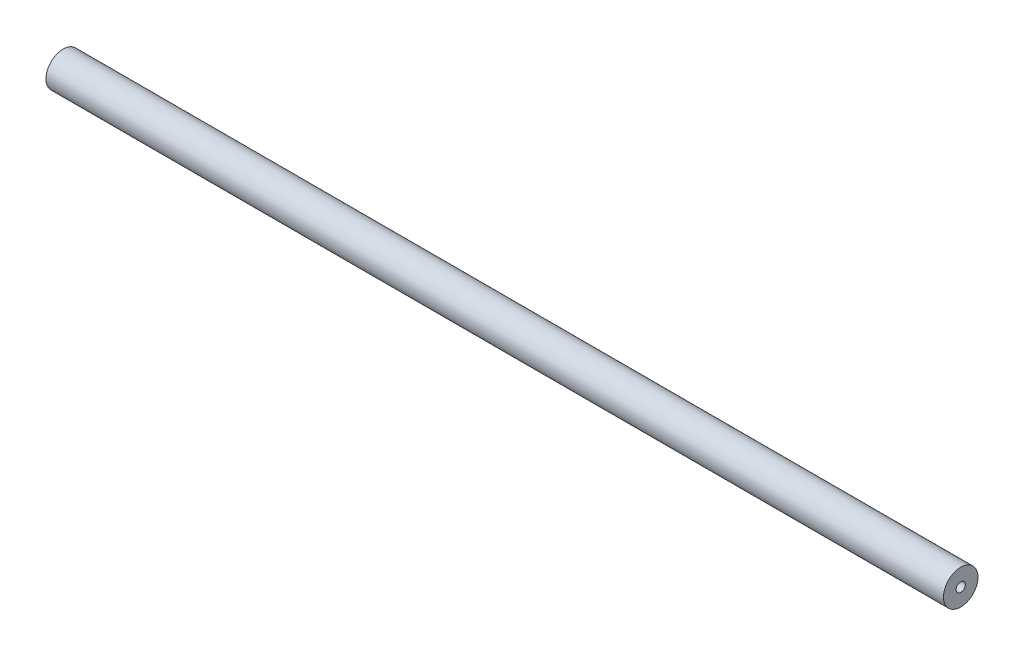
from build123d import *

# Parameters (mm, degrees)
SKETCH1_R                   = 9.525
BOSS_EXTRUDE1_DEPTH         = 495.3
F_1_4_20_TAPPED_HOLE1_D     = 5.1054
F_1_4_20_TAPPED_HOLE1_DEPTH = 16.51
F_1_4_20_TAPPED_HOLE1_TIP   = 1.533816902
F_1_4_20_TAPPED_HOLE2_D     = 5.1054
F_1_4_20_TAPPED_HOLE2_DEPTH = 16.51
F_1_4_20_TAPPED_HOLE2_TIP   = 1.533816902


with BuildPart() as part:
    # Sketch1 → Boss-Extrude1 (new body)
    with BuildSketch(Plane(origin=(0, 0, 0), x_dir=(0, 0, -1), z_dir=(1, 0, 0))):
        Circle(SKETCH1_R)
    extrude(amount=-BOSS_EXTRUDE1_DEPTH)

    # 1/4-20 Tapped Hole1
    with Locations(Plane(origin=(0, 0, 0), x_dir=(0, 0, -1), z_dir=(1, 0, 0))):
        with Locations((0, 0)):
            Hole(F_1_4_20_TAPPED_HOLE1_D / 2, depth=F_1_4_20_TAPPED_HOLE1_DEPTH)
            with Locations((0, 0, -(F_1_4_20_TAPPED_HOLE1_DEPTH + F_1_4_20_TAPPED_HOLE1_TIP / 2))):  # 118° drill point
                Cone(0, F_1_4_20_TAPPED_HOLE1_D / 2, F_1_4_20_TAPPED_HOLE1_TIP, mode=Mode.SUBTRACT)

    # 1/4-20 Tapped Hole2
    with Locations(Plane.ZY.offset(495.3)):
        with Locations((0, 0)):
            Hole(F_1_4_20_TAPPED_HOLE2_D / 2, depth=F_1_4_20_TAPPED_HOLE2_DEPTH)
            with Locations((0, 0, -(F_1_4_20_TAPPED_HOLE2_DEPTH + F_1_4_20_TAPPED_HOLE2_TIP / 2))):  # 118° drill point
                Cone(0, F_1_4_20_TAPPED_HOLE2_D / 2, F_1_4_20_TAPPED_HOLE2_TIP, mode=Mode.SUBTRACT)


solid = part.part
